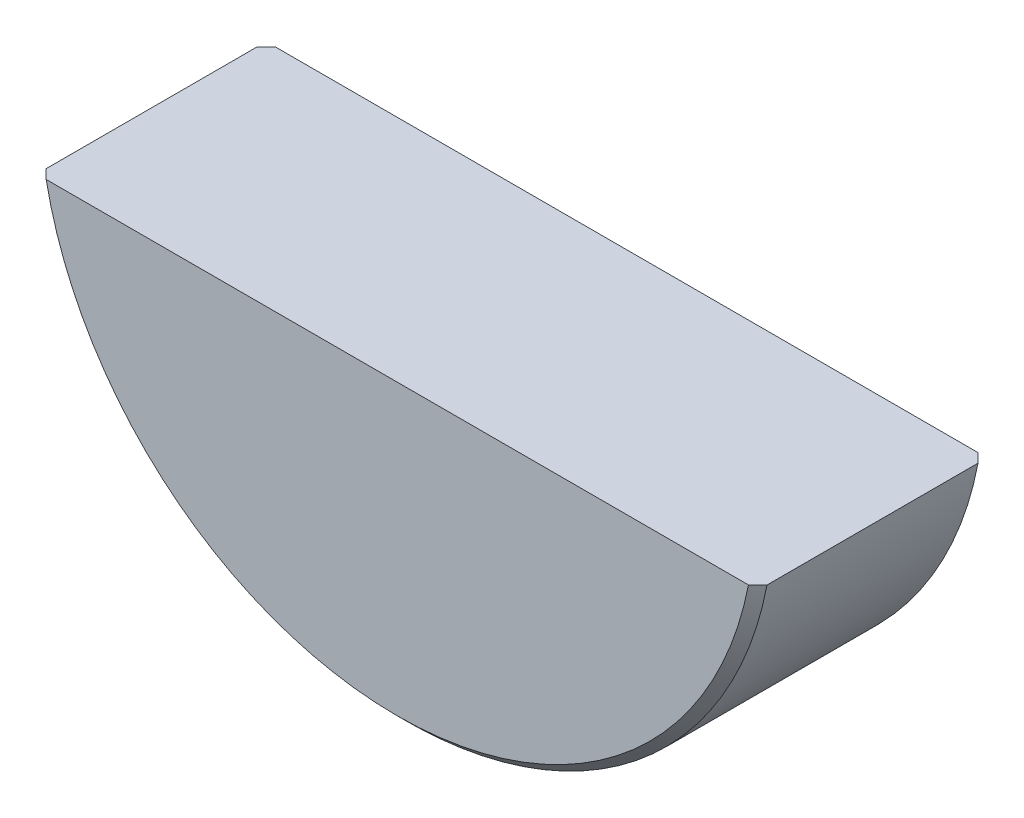
from build123d import *

# Parameters (mm, degrees)
EXTRUDE_387_DEPTH = 10
CHAMFER_1_SIZE    = 0.4


with BuildPart() as part:
    # 草图1 → Extrude 387 (new body)
    with BuildSketch(Plane.XY):
        with BuildLine():
            Line((-15.716233646, -3), (15.716233646, -3))
            ThreePointArc((15.716233646, -3), (0, -16), (-15.716233646, -3))
        make_face()
    extrude(amount=EXTRUDE_387_DEPTH)

    # 倒角1
    chamfer_1_edges = [part.edges().sort_by_distance(p)[0] for p in [
        (0, -16, 0),
        (0, -16, 10),
    ]]
    chamfer(chamfer_1_edges, length=CHAMFER_1_SIZE)


solid = part.part
